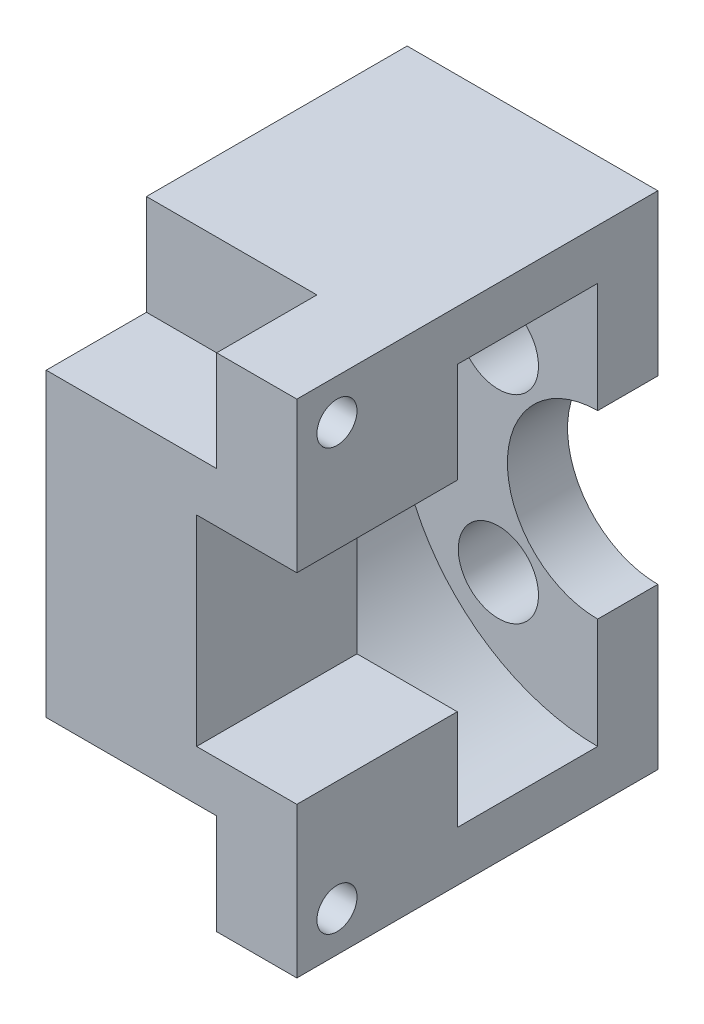
from build123d import *

# Parameters (mm, degrees)
SKETCH_1_W               = 25
SKETCH_1_H               = 25
EXTRUDE_1_DEPTH          = 10
SKETCH_2_R               = 10
CUT_EXTRUDE_1_DEPTH      = 7
SKETCH_3_R               = 4.5
CUT_EXTRUDE_2_DEPTH      = 20.013153342
SKETCH_4_R               = 2
CUT_EXTRUDE_4_DEPTH      = 20.013153342
PATTERN_CIRCULAR_1_COUNT = 4
SKETCH_5_W               = 25
SKETCH_5_H               = 25
EXTRUDE_2_DEPTH          = 8
SKETCH_6_W               = 10
SKETCH_6_H               = 10
CUT_EXTRUDE_5_DEPTH      = 8
SKETCH_8_W               = 17.447834749
SKETCH_8_H               = 20.945056097
CUT_EXTRUDE_8_DEPTH      = 34.24530042
CUT_EXTRUDE_START        = -4
SKETCH_12_W              = 5
SKETCH_12_H              = 5
CUT_EXTRUDE_9_DEPTH      = 22.228951623
SKETCH_13_R              = 1
CUT_EXTRUDE_10_DEPTH     = 24.505318547


with BuildPart() as part:
    # 草图1 → 凸台-拉伸1 (new body)
    with BuildSketch(Plane.XY):
        Rectangle(SKETCH_1_W, SKETCH_1_H)
    extrude(amount=EXTRUDE_1_DEPTH)

    # 草图2 → 切除-拉伸1 (cut)
    with BuildSketch(Plane.XY.offset(10)):
        Circle(SKETCH_2_R)
    extrude(amount=-CUT_EXTRUDE_1_DEPTH, mode=Mode.SUBTRACT)

    # 草图3 → 切除-拉伸2 (cut, through all)
    with BuildSketch(Plane.XY.offset(3)):
        Circle(SKETCH_3_R)
    extrude(amount=-CUT_EXTRUDE_2_DEPTH, mode=Mode.SUBTRACT)

    # 草图4 → 切除-拉伸4 (cut, through all)
    with BuildSketch(Plane.XY.offset(3)):
        with Locations((-4.949747468, 4.949747468)):
            Circle(SKETCH_4_R)
    cut_extrude_4 = extrude(amount=-CUT_EXTRUDE_4_DEPTH, mode=Mode.SUBTRACT)

    # 阵列(圆周)1: 切除-拉伸4 ×4 about axis
    pattern_circular_1_axis = Axis((0, 0, 0), (0, 0, 1))
    for i in range(1, PATTERN_CIRCULAR_1_COUNT):
        add(cut_extrude_4.rotate(pattern_circular_1_axis, i * 360 / PATTERN_CIRCULAR_1_COUNT), mode=Mode.SUBTRACT)

    # 草图5 → 凸台-拉伸2 (add)
    with BuildSketch(Plane.XY.offset(10)):
        Rectangle(SKETCH_5_W, SKETCH_5_H)
    extrude(amount=EXTRUDE_2_DEPTH)

    # 草图6 → 切除-拉伸5 (cut)
    with BuildSketch(Plane.XY.offset(18)):
        Rectangle(SKETCH_6_W, SKETCH_6_H)
    extrude(amount=-CUT_EXTRUDE_5_DEPTH, mode=Mode.SUBTRACT)

    # 草图8 → 切除-拉伸8 (cut, through all)
    with BuildSketch(Plane.XZ.offset(12.5)):
        with Locations((8.723917375, 10.472528049)):
            Rectangle(SKETCH_8_W, SKETCH_8_H)
    extrude(amount=-CUT_EXTRUDE_8_DEPTH, mode=Mode.SUBTRACT)

    # 草图12 → 切除-拉伸9 (cut, through all)
    with BuildSketch(Plane(origin=(0, 0, 0), x_dir=(0, 0, -1), z_dir=(1, 0, 0)).offset(CUT_EXTRUDE_START)):
        with Locations((-15.5, -10)):
            Rectangle(SKETCH_12_W, SKETCH_12_H)
    cut_extrude_9 = extrude(amount=-CUT_EXTRUDE_9_DEPTH, mode=Mode.SUBTRACT)

    # 镜向1: 切除-拉伸9 across plane
    add(cut_extrude_9.mirror(Plane.ZX), mode=Mode.SUBTRACT)

    # 草图13 → 切除-拉伸10 (cut, through all)
    with BuildSketch(Plane.ZY.offset(4)):
        with Locations((16, -10.5)):
            Circle(SKETCH_13_R)
    cut_extrude_10 = extrude(amount=-CUT_EXTRUDE_10_DEPTH, mode=Mode.SUBTRACT)

    # 镜向2: 切除-拉伸10 across plane
    add(cut_extrude_10.mirror(Plane.ZX), mode=Mode.SUBTRACT)


solid = part.part
